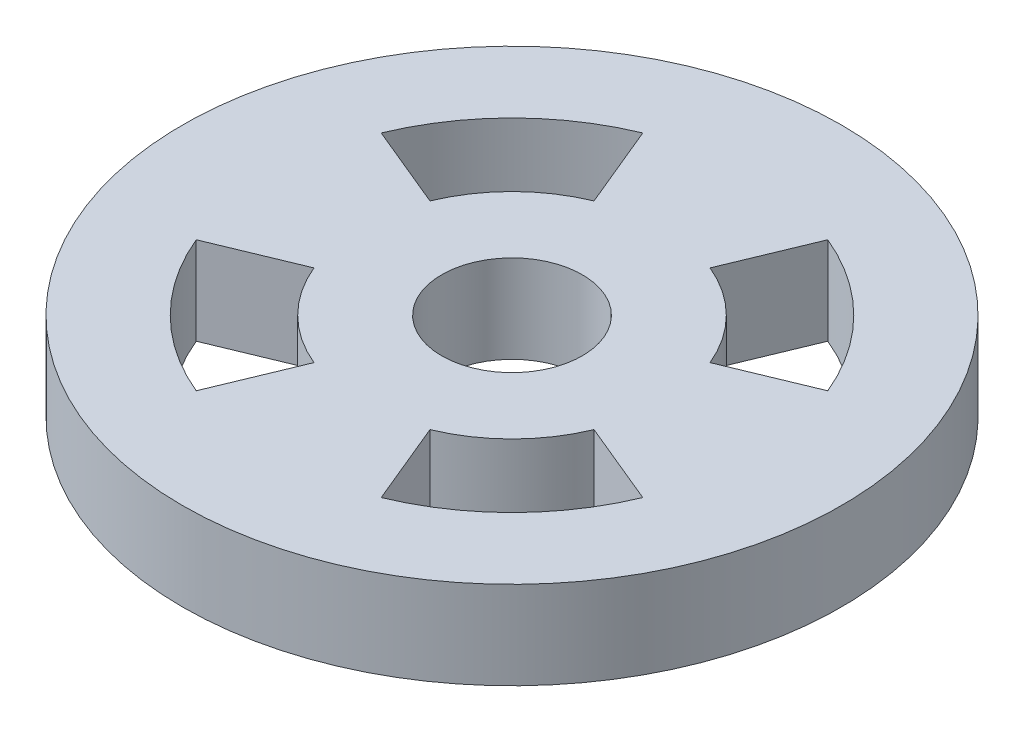
from build123d import *

# Parameters (mm, degrees)
SKETCH1_R           = 7.5
SKETCH1_R_2         = 1.6
BOSS_EXTRUDE1_DEPTH = 2


with BuildPart() as part:
    # Sketch1 → Boss-Extrude1 (new body)
    with BuildSketch(Plane(origin=(0, 0, 0), x_dir=(1, 0, 0), z_dir=(0, 1, 0))):
        with Locations(Location((0, 0, 0), (0, 0, 270))):
            Circle(SKETCH1_R)
        with Locations(Location((0, 0, 0), (0, 0, 270))):
            Circle(SKETCH1_R_2, mode=Mode.SUBTRACT)
        with BuildLine():
            Line((-1.319908308, 3.186540538), (-2.104758878, 5.081337429))
            ThreePointArc((-2.104758878, 5.081337429), (-3.889087297, 3.889087297), (-5.081337429, 2.104758878))
            Line((-5.081337429, 2.104758878), (-3.186540538, 1.319908308))
            ThreePointArc((-3.186540538, 1.319908308), (-2.438872541, 2.438872541), (-1.319908308, 3.186540538))
        make_face(mode=Mode.SUBTRACT)
        with BuildLine():
            Line((1.319908308, 3.186540538), (2.104758878, 5.081337429))
            ThreePointArc((2.104758878, 5.081337429), (3.889087297, 3.889087297), (5.081337429, 2.104758878))
            Line((5.081337429, 2.104758878), (3.186540538, 1.319908308))
            ThreePointArc((3.186540538, 1.319908308), (2.438872541, 2.438872541), (1.319908308, 3.186540538))
        make_face(mode=Mode.SUBTRACT)
        with BuildLine():
            Line((3.186540538, -1.319908308), (5.081337429, -2.104758878))
            ThreePointArc((5.081337429, -2.104758878), (3.889087297, -3.889087297), (2.104758878, -5.081337429))
            Line((2.104758878, -5.081337429), (1.319908308, -3.186540538))
            ThreePointArc((1.319908308, -3.186540538), (2.438872541, -2.438872541), (3.186540538, -1.319908308))
        make_face(mode=Mode.SUBTRACT)
        with BuildLine():
            Line((-1.319908308, -3.186540538), (-2.104758878, -5.081337429))
            ThreePointArc((-2.104758878, -5.081337429), (-3.889087297, -3.889087297), (-5.081337429, -2.104758878))
            Line((-5.081337429, -2.104758878), (-3.186540538, -1.319908308))
            ThreePointArc((-3.186540538, -1.319908308), (-2.438872541, -2.438872541), (-1.319908308, -3.186540538))
        make_face(mode=Mode.SUBTRACT)
    extrude(amount=BOSS_EXTRUDE1_DEPTH)


solid = part.part
